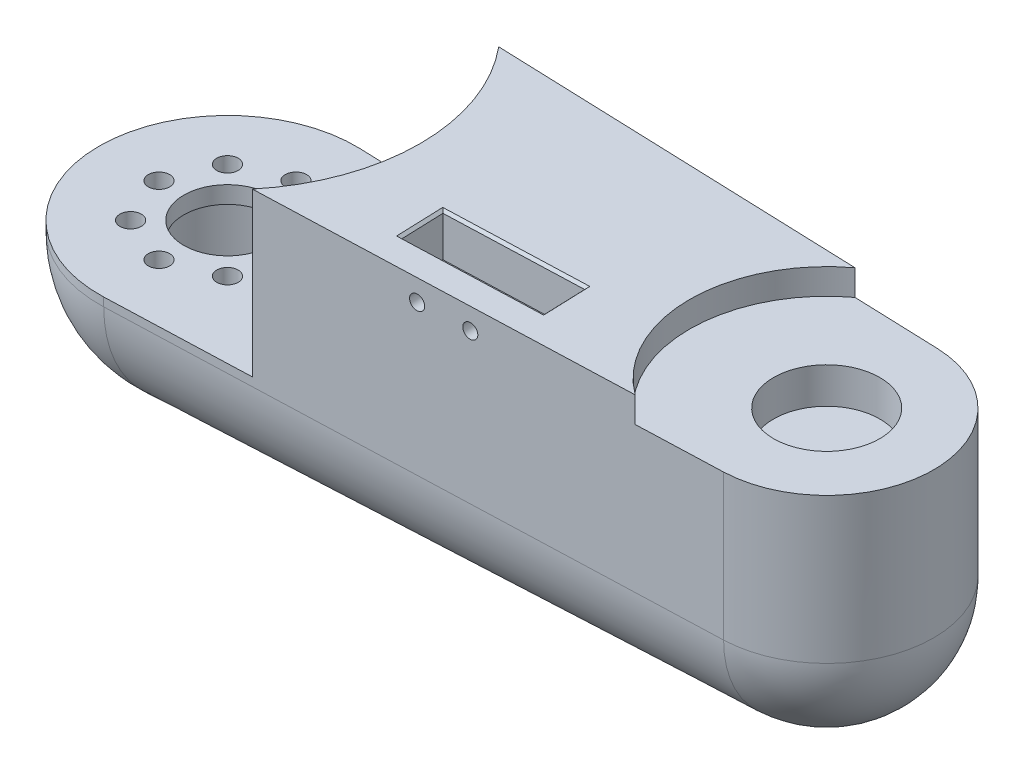
from build123d import *

# Parameters (mm, degrees)
EXTRUDE_1_DEPTH     = 20
REVOLVE_1_ANGLE     = 180
CUT_EXTRUDE_START   = -19
CUT_EXTRUDE_1_DEPTH = 19
SKETCH_5_R          = 10
CUT_EXTRUDE_2_DEPTH = 87.442177205
SKETCH_4_R          = 1.25
SKETCH_4_R_2        = 5.1
CUT_EXTRUDE_3_DEPTH = 86.97819491
CUT_EXTRUDE_START_2 = -3
CUT_EXTRUDE_5_DEPTH = 3
SKETCH_6_R          = 6.2
CUT_EXTRUDE_4_DEPTH = 4.2
CUT_EXTRUDE_6_DEPTH = 5
HOLE_WIZARD_1_D     = 1.7
HOLE_WIZARD_1_DEPTH = 3.5
CHAMFER_1_SIZE      = 0.3


with BuildPart() as part:
    # 草图2 → 凸台-拉伸1 (new body)
    with BuildSketch(Plane(origin=(0, 0, 0), x_dir=(1, 0, 0), z_dir=(0, 1, 0))):
        with BuildLine():
            Line((70.446428571, 12.492025518), (0.535714286, 14.990430621))
            ThreePointArc((0.535714286, 14.990430621), (-10.415476122, 10.794343757), (-15, 0))
            Line((-15, 0), (82.5, 0))
            ThreePointArc((82.5, 0), (78.995286464, 8.679563435), (70.446428571, 12.492025518))
        make_face()
        with BuildLine():
            Line((82.5, 0), (-15, 0))
            ThreePointArc((-15, 0), (-10.415476122, -10.794343757), (0.535714286, -14.990430621))
            Line((0.535714286, -14.990430621), (70.446428571, -12.492025518))
            ThreePointArc((70.446428571, -12.492025518), (78.995286464, -8.679563435), (82.5, 0))
        make_face()
    extrude(amount=EXTRUDE_1_DEPTH)

    # 草图1 → 旋转1 (revolve)
    with BuildSketch(Plane(origin=(0, 0, 0), x_dir=(1, 0, 0), z_dir=(0, 1, 0))):
        with BuildLine():
            Line((0.535714286, -14.990430621), (70.446428571, -12.492025518))
            ThreePointArc((70.446428571, -12.492025518), (78.995286464, -8.679563435), (82.5, 0))
            Line((82.5, 0), (-15, 0))
            ThreePointArc((-15, 0), (-10.415476122, -10.794343757), (0.535714286, -14.990430621))
        make_face()
    revolve(axis=Axis((70, 0, 0), (1, 0, 0)), revolution_arc=REVOLVE_1_ANGLE)

    # 草图3 → 切除-拉伸1 (cut)
    with BuildSketch(Plane(origin=(0, 20, 0), x_dir=(1, 0, 0), z_dir=(0, 1, 0)).offset(CUT_EXTRUDE_START)):
        with BuildLine():
            Line((17.295525226, 14.391483841), (0.535714286, 14.990430621))
            ThreePointArc((0.535714286, 14.990430621), (-15, 0), (0.535714286, -14.990430621))
            Line((0.535714286, -14.990430621), (17.295525226, -14.391483841))
            ThreePointArc((17.295525226, -14.391483841), (22.5, 0), (17.295525226, 14.391483841))
        make_face()
    extrude(amount=CUT_EXTRUDE_1_DEPTH, mode=Mode.SUBTRACT)

    # 草图5 → 切除-拉伸2 (cut, through all)
    with BuildSketch(Plane(origin=(0, -1, 0), x_dir=(1, 0, 0), z_dir=(0, 1, 0))):
        with Locations(Location((0, 0, 0), (0, 0, 270))):
            Circle(SKETCH_5_R)
    extrude(amount=-CUT_EXTRUDE_2_DEPTH, mode=Mode.SUBTRACT)

    # 草图4 → 切除-拉伸3 (cut, through all)
    with BuildSketch(Plane(origin=(0, 1, 0), x_dir=(1, 0, 0), z_dir=(0, 1, 0))):
        with Locations(Location((8, 0, 0), (0, 0, 270))):
            Circle(SKETCH_4_R)
        with Locations(Location((5.656854249, -5.656854249, 0), (0, 0, 270))):
            Circle(SKETCH_4_R)
        with Locations(Location((0, -8, 0), (0, 0, 270))):
            Circle(SKETCH_4_R)
        with Locations(Location((-5.656854249, -5.656854249, 0), (0, 0, 270))):
            Circle(SKETCH_4_R)
        with Locations(Location((-8, 0, 0), (0, 0, 270))):
            Circle(SKETCH_4_R)
        with Locations(Location((-5.656854249, 5.656854249, 0), (0, 0, 270))):
            Circle(SKETCH_4_R)
        with Locations(Location((0, 8, 0), (0, 0, 270))):
            Circle(SKETCH_4_R)
        with Locations(Location((5.656854249, 5.656854249, 0), (0, 0, 270))):
            Circle(SKETCH_4_R)
        with Locations(Location((0, 0, 0), (0, 0, 270))):
            Circle(SKETCH_4_R_2)
    extrude(amount=-CUT_EXTRUDE_3_DEPTH, mode=Mode.SUBTRACT)

    # 草图11 → 切除-拉伸5 (cut)
    with BuildSketch(Plane(origin=(0, 20, 0), x_dir=(1, 0, 0), z_dir=(0, 1, 0)).offset(CUT_EXTRUDE_START_2)):
        with BuildLine():
            Line((60.465308, 12.848721667), (70.446428571, 12.492025518))
            ThreePointArc((70.446428571, 12.492025518), (82.5, 0), (70.446428571, -12.492025518))
            Line((70.446428571, -12.492025518), (60.465308, -12.848721667))
            ThreePointArc((60.465308, -12.848721667), (54, 0), (60.465308, 12.848721667))
        make_face()
    extrude(amount=CUT_EXTRUDE_5_DEPTH, mode=Mode.SUBTRACT)

    # 草图6 → 切除-拉伸4 (cut)
    with BuildSketch(Plane(origin=(0, 17, 0), x_dir=(1, 0, 0), z_dir=(0, 1, 0))):
        with Locations(Location((70, 0, 0), (0, 0, 270))):
            Circle(SKETCH_6_R)
    extrude(amount=-CUT_EXTRUDE_4_DEPTH, mode=Mode.SUBTRACT)

    # 草图12 → 切除-拉伸6 (cut)
    with BuildSketch(Plane(origin=(0, 20, 0), x_dir=(1, 0, 0), z_dir=(0, 1, 0))):
        Polygon((30.581948853, -5.411239688), (30.760520282, -10.408049895), (38.755416613, -10.122335609), (38.576845185, -5.125525402), align=None)
        Polygon((38.576845185, -5.125525402), (38.755416613, -10.122335609), (46.750312944, -9.836621323), (46.571741516, -4.839811116), align=None)
    extrude(amount=-CUT_EXTRUDE_6_DEPTH, mode=Mode.SUBTRACT)

    # 孔1
    with Locations(Plane(origin=(0.535714286, 0, 14.990430621), x_dir=(0.9993620414023731, 0, -0.035714285714285726), z_dir=(0.035714285714285726, 0, 0.9993620414023731))):
        with Locations((35.369180276, 17.5), (41.369180276, 17.5)):
            Hole(HOLE_WIZARD_1_D / 2, depth=HOLE_WIZARD_1_DEPTH)

    # 倒角1
    chamfer_1_edges = [part.edges().sort_by_distance(p)[0] for p in [
        (38.755416613, 20, 10.122335609),
        (46.66102723, 20, 7.33821622),
        (38.576845185, 20, 5.125525402),
        (30.671234568, 20, 7.909644791),
    ]]
    chamfer(chamfer_1_edges, length=CHAMFER_1_SIZE)


solid = part.part
